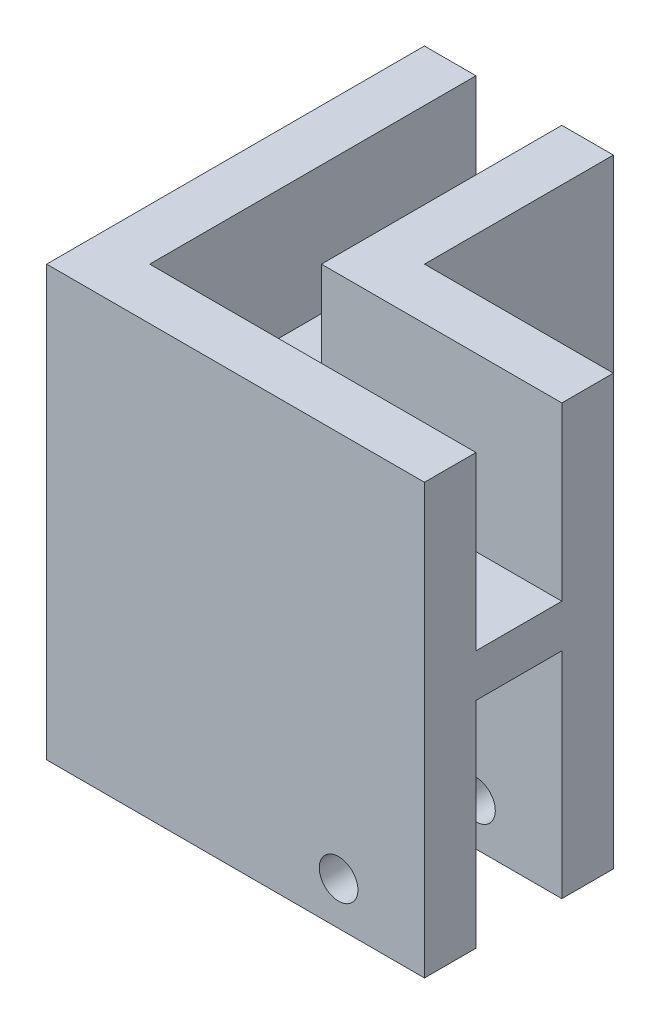
from build123d import *

# Parameters (mm, degrees)
ESTRUSIONE_ESTRUSIONE1_DEPTH = 28
ESTRUSIONE_ESTRUSIONE2_DEPTH = 16
SCHIZZO4_W                   = 16
SCHIZZO4_H                   = 50
ESTRUSIONE_ESTRUSIONE3_DEPTH = 6
ESTRUSIONE_ESTRUSIONE4_DEPTH = 22
FORO_PER_VITE_M4_1_D         = 4.5
FORO_PER_VITE_M4_1_DEPTH     = 30
FORO_PER_VITE_M4_1_TIP       = 1.351936393
FORO_PER_VITE_M4_2_D         = 4.5
FORO_PER_VITE_M4_2_DEPTH     = 30
FORO_PER_VITE_M4_2_TIP       = 1.351936393
SCHIZZO10_W                  = 10
SCHIZZO10_H                  = 5
TAGLIO_ESTRUSIONE1_DEPTH     = 6


with BuildPart() as part:
    # Schizzo2 → Estrusione-Estrusione1 (new body)
    with BuildSketch(Plane.XY):
        Polygon((0, 0), (-10, 0), (-10, -25), (-16, -25), (-16, 25), (-10, 25), (-10, 10), (0, 10), (0, 25), (6, 25), (6, -25), (0, -25), align=None)
    extrude(amount=ESTRUSIONE_ESTRUSIONE1_DEPTH)

    # Schizzo3 → Estrusione-Estrusione2 (add)
    with BuildSketch(Plane(origin=(6, 0, 0), x_dir=(0, 0, -1), z_dir=(1, 0, 0))):
        Polygon((-28, 0), (-38, 0), (-38, -25), (-44, -25), (-44, 25), (-38, 25), (-38, 10), (-28, 10), align=None)
    extrude(amount=-ESTRUSIONE_ESTRUSIONE2_DEPTH)

    # Schizzo4 → Estrusione-Estrusione3 (add)
    with BuildSketch(Plane.ZY.offset(10)):
        with Locations((36, 0)):
            Rectangle(SCHIZZO4_W, SCHIZZO4_H)
    extrude(amount=ESTRUSIONE_ESTRUSIONE3_DEPTH)

    # Schizzo5 → Estrusione-Estrusione4 (add)
    with BuildSketch(Plane(origin=(6, 0, 0), x_dir=(0, 0, -1), z_dir=(1, 0, 0))):
        Polygon((-38, -25), (-44, -25), (-44, 25), (-38, 25), (-38, 5), (-28, 5), (-28, 25), (-22, 25), (-22, -25), (-28, -25), (-28, 0), (-38, 0), align=None)
    extrude(amount=ESTRUSIONE_ESTRUSIONE4_DEPTH)

    # Foro per Vite M4-1
    with Locations(Plane.XY.offset(44)):
        with Locations((18, -20)):
            Hole(FORO_PER_VITE_M4_1_D / 2, depth=FORO_PER_VITE_M4_1_DEPTH)
            with Locations((0, 0, -(FORO_PER_VITE_M4_1_DEPTH + FORO_PER_VITE_M4_1_TIP / 2))):  # 118° drill point
                Cone(0, FORO_PER_VITE_M4_1_D / 2, FORO_PER_VITE_M4_1_TIP, mode=Mode.SUBTRACT)

    # Foro per Vite M4-2
    with Locations(Plane.ZY.offset(16)):
        with Locations((10, -20)):
            Hole(FORO_PER_VITE_M4_2_D / 2, depth=FORO_PER_VITE_M4_2_DEPTH)
            with Locations((0, 0, -(FORO_PER_VITE_M4_2_DEPTH + FORO_PER_VITE_M4_2_TIP / 2))):  # 118° drill point
                Cone(0, FORO_PER_VITE_M4_2_D / 2, FORO_PER_VITE_M4_2_TIP, mode=Mode.SUBTRACT)

    # Schizzo10 → Taglio-Estrusione1 (cut)
    with BuildSketch(Plane(origin=(6, 0, 0), x_dir=(0, 0, -1), z_dir=(1, 0, 0))):
        with Locations((-33, 7.5)):
            Rectangle(SCHIZZO10_W, SCHIZZO10_H)
    extrude(amount=-TAGLIO_ESTRUSIONE1_DEPTH, mode=Mode.SUBTRACT)


solid = part.part
